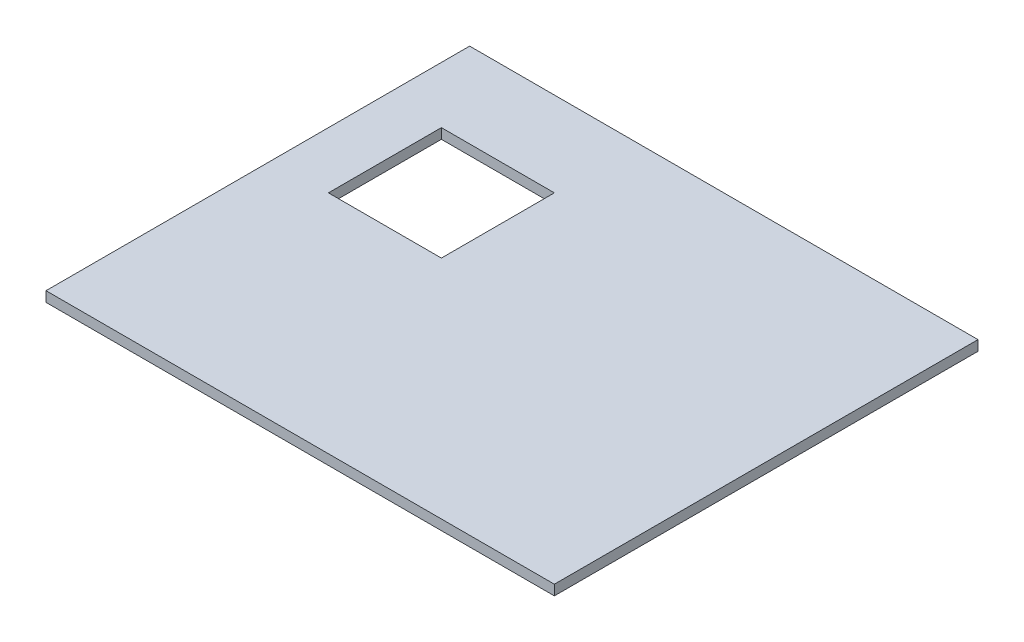
from build123d import *

# Parameters (mm, degrees)
SKETCH1_W           = 914.4
SKETCH1_H           = 762
SKETCH1_W_2         = 203.2
SKETCH1_H_2         = 203.2
BOSS_EXTRUDE1_DEPTH = 18.25625


with BuildPart() as part:
    # Sketch1 → Boss-Extrude1 (new body)
    with BuildSketch(Plane(origin=(0, 0, 0), x_dir=(1, 0, 0), z_dir=(0, 1, 0))):
        Rectangle(SKETCH1_W, SKETCH1_H)
        with Locations((-254, 127)):
            Rectangle(SKETCH1_W_2, SKETCH1_H_2, mode=Mode.SUBTRACT)
    extrude(amount=BOSS_EXTRUDE1_DEPTH)


solid = part.part
